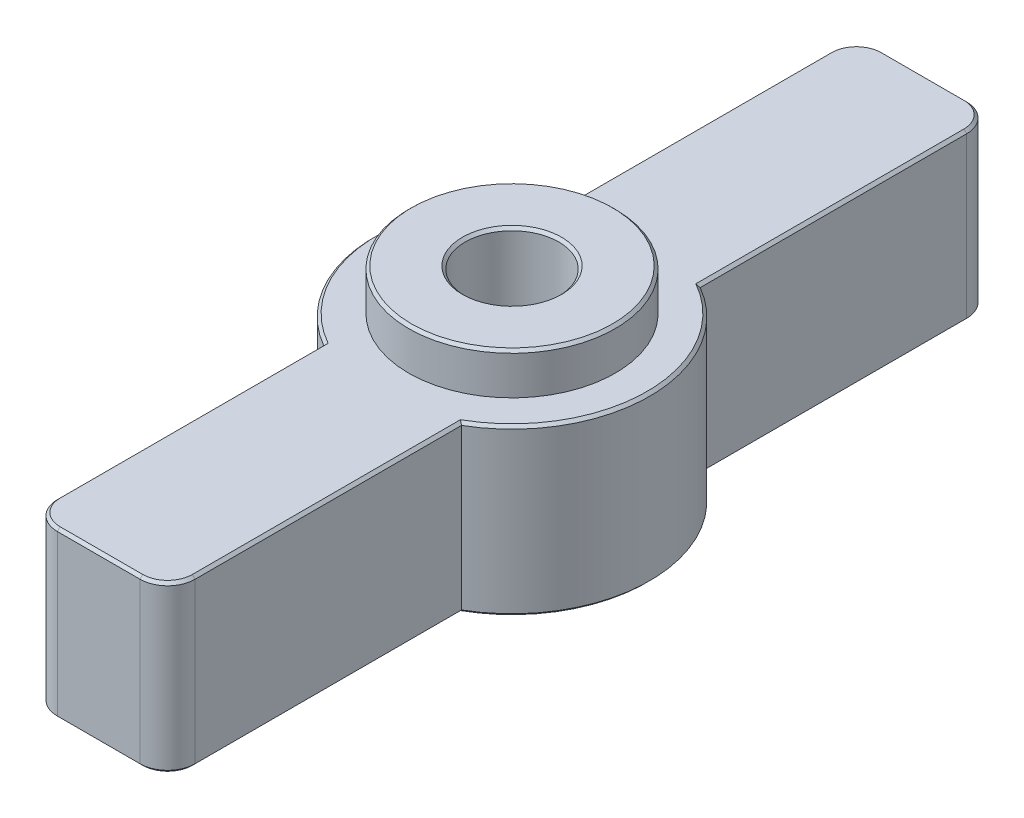
from build123d import *

# Parameters (mm, degrees)
BOSS_EXTRUDE1_DEPTH = 12
SKETCH_2_R          = 6.75
CUT_EXTRUDE1_DEPTH  = 8.5
SKETCH_4_R          = 7.5
BOSS_EXTRUDE2_DEPTH = 3
SKETCH_3_R          = 3.4
CUT_EXTRUDE2_DEPTH  = 33.74522866
FILLET1_SIZE        = 0.2


with BuildPart() as part:
    # 草图1 → Boss-Extrude1 (new body)
    with BuildSketch(Plane(origin=(0, 0, 0), x_dir=(1, 0, 0), z_dir=(0, 1, 0))):
        with BuildLine():
            Line((-5, -28), (-5, -8.660254038))
            ThreePointArc((-5, -8.660254038), (-10, 0), (-5, 8.660254038))
            Line((-5, 8.660254038), (-5, 28))
            ThreePointArc((-5, 28), (-4.414213562, 29.414213562), (-3, 30))
            Line((-3, 30), (3, 30))
            ThreePointArc((3, 30), (4.414213562, 29.414213562), (5, 28))
            Line((5, 28), (5, 8.660254038))
            ThreePointArc((5, 8.660254038), (10, 0), (5, -8.660254038))
            Line((5, -8.660254038), (5, -28))
            ThreePointArc((5, -28), (4.414213562, -29.414213562), (3, -30))
            Line((3, -30), (-3, -30))
            ThreePointArc((-3, -30), (-4.414213562, -29.414213562), (-5, -28))
        make_face()
    extrude(amount=BOSS_EXTRUDE1_DEPTH)

    # 草图2 → Cut-Extrude1 (cut)
    with BuildSketch(Plane.XZ):
        with Locations(Location((0, 0, 0), (0, 0, 270))):
            Circle(SKETCH_2_R)
    extrude(amount=-CUT_EXTRUDE1_DEPTH, mode=Mode.SUBTRACT)

    # 草图4 → Boss-Extrude2 (add)
    with BuildSketch(Plane(origin=(0, 12, 0), x_dir=(1, 0, 0), z_dir=(0, 1, 0))):
        with Locations(Location((0, 0, 0), (0, 0, 270))):
            Circle(SKETCH_4_R)
    extrude(amount=BOSS_EXTRUDE2_DEPTH)

    # 草图3 → Cut-Extrude2 (cut, through all)
    with BuildSketch(Plane.XZ.offset(-8.5)):
        with Locations(Location((0, 0, 0), (0, 0, 270))):
            Circle(SKETCH_3_R)
    extrude(amount=-CUT_EXTRUDE2_DEPTH, mode=Mode.SUBTRACT)

    # Fillet1
    fillet1_edges = [part.edges().sort_by_distance(p)[0] for p in [
        (5, 0, 18.330127019),
        (4.414213562, 0, 29.414213562),
        (4.414213562, 12, -29.414213562),
        (0, 0, 30),
        (-4.414213562, 0, 29.414213562),
        (-5, 0, 18.330127019),
        (-10, 0, 0),
        (-5, 0, -18.330127019),
        (-4.414213562, 0, -29.414213562),
        (0, 0, -30),
        (4.414213562, 0, -29.414213562),
        (5, 0, -18.330127019),
        (10, 0, 0),
        (0, 12, -30),
        (-4.414213562, 12, -29.414213562),
        (-5, 12, -18.330127019),
        (-10, 12, 0),
        (-5, 12, 18.330127019),
        (-4.414213562, 12, 29.414213562),
        (0, 0, 6.75),
        (0, 12, 30),
        (0, 15, -7.5),
        (4.414213562, 12, 29.414213562),
        (0, 15, 3.4),
        (5, 12, 18.330127019),
        (10, 12, 0),
        (5, 12, -18.330127019),
    ]]
    chamfer(fillet1_edges, length=FILLET1_SIZE)


solid = part.part
